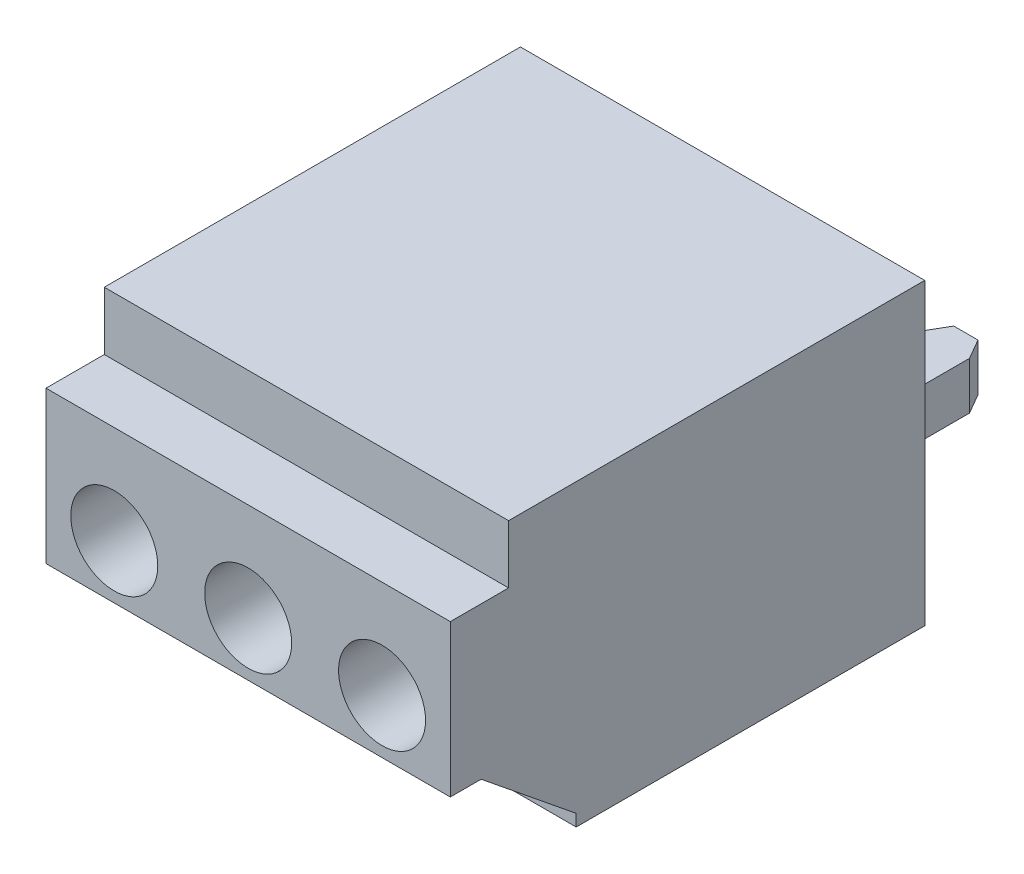
from build123d import *
from OCP.BRepFilletAPI import BRepFilletAPI_MakeChamfer

# Parameters (mm, degrees)
SKETCH1_W           = 15.34
SKETCH1_H           = 11.35
BOSS_EXTRUDE1_DEPTH = 18
SKETCH1_3_W         = 1.8
SKETCH1_3_H         = 1.8
BOSS_EXTRUDE2_DEPTH = 4
CHAMFER1_SIZE       = 0.762
CHAMFER1_SIZE2      = 0.439940905
SKETCH3_W           = 2.211259549
SKETCH3_H           = 2.211259549
CUT_EXTRUDE1_DEPTH  = 27.232386472
SKETCH4_R           = 1.650097839
CUT_EXTRUDE2_DEPTH  = 4
SKETCH2_W           = 3.858538726
SKETCH2_H           = 3.6
CUT_EXTRUDE3_DEPTH  = 4


with BuildPart() as part:
    # Sketch1 → Boss-Extrude1 (new body)
    with BuildSketch(Plane.XY):
        with Locations((7.67, 5.675)):
            Rectangle(SKETCH1_W, SKETCH1_H)
    extrude(amount=BOSS_EXTRUDE1_DEPTH)

    # Sketch1<3> → Boss-Extrude2 (add)
    with BuildSketch(Plane.XY):
        with Locations((2.54, 5.5)):
            Rectangle(SKETCH1_3_W, SKETCH1_3_H)
        with Locations((7.72, 5.5)):
            Rectangle(SKETCH1_3_W, SKETCH1_3_H)
        with Locations((12.9, 5.5)):
            Rectangle(SKETCH1_3_W, SKETCH1_3_H)
    extrude(amount=-BOSS_EXTRUDE2_DEPTH)

    # Chamfer1: one chamfer whose edges measure the first distance from different faces: ONE call of the kernel's chamfer builder (chamfer() names one face for all edges)
    chamfer1_edges_1 = [part.edges().sort_by_distance(p)[0] for p in [
        (1.64, 5.5, -4),
    ]]
    chamfer1_side_1 = [part.faces().sort_by_distance(p)[0] for p in [
        (1.64, 5.5, -2),
    ]]
    chamfer1_edges_2 = [part.edges().sort_by_distance(p)[0] for p in [
        (3.44, 5.5, -4),
    ]]
    chamfer1_side_2 = [part.faces().sort_by_distance(p)[0] for p in [
        (3.44, 5.5, -2),
    ]]
    chamfer1_edges_3 = [part.edges().sort_by_distance(p)[0] for p in [
        (6.82, 5.5, -4),
    ]]
    chamfer1_side_3 = [part.faces().sort_by_distance(p)[0] for p in [
        (6.82, 5.5, -2),
    ]]
    chamfer1_edges_4 = [part.edges().sort_by_distance(p)[0] for p in [
        (8.62, 5.5, -4),
    ]]
    chamfer1_side_4 = [part.faces().sort_by_distance(p)[0] for p in [
        (8.62, 5.5, -2),
    ]]
    chamfer1_edges_5 = [part.edges().sort_by_distance(p)[0] for p in [
        (12, 5.5, -4),
    ]]
    chamfer1_side_5 = [part.faces().sort_by_distance(p)[0] for p in [
        (12, 5.5, -2),
    ]]
    chamfer1_edges_6 = [part.edges().sort_by_distance(p)[0] for p in [
        (13.8, 5.5, -4),
    ]]
    chamfer1_side_6 = [part.faces().sort_by_distance(p)[0] for p in [
        (13.8, 5.5, -2),
    ]]
    chamfer1 = BRepFilletAPI_MakeChamfer(part.part.solid().wrapped)
    for e in chamfer1_edges_1:
        chamfer1.Add(CHAMFER1_SIZE, CHAMFER1_SIZE2, e.wrapped, chamfer1_side_1[0].wrapped)  # the first distance lies on this face
    for e in chamfer1_edges_2:
        chamfer1.Add(CHAMFER1_SIZE, CHAMFER1_SIZE2, e.wrapped, chamfer1_side_2[0].wrapped)  # the first distance lies on this face
    for e in chamfer1_edges_3:
        chamfer1.Add(CHAMFER1_SIZE, CHAMFER1_SIZE2, e.wrapped, chamfer1_side_3[0].wrapped)  # the first distance lies on this face
    for e in chamfer1_edges_4:
        chamfer1.Add(CHAMFER1_SIZE, CHAMFER1_SIZE2, e.wrapped, chamfer1_side_4[0].wrapped)  # the first distance lies on this face
    for e in chamfer1_edges_5:
        chamfer1.Add(CHAMFER1_SIZE, CHAMFER1_SIZE2, e.wrapped, chamfer1_side_5[0].wrapped)  # the first distance lies on this face
    for e in chamfer1_edges_6:
        chamfer1.Add(CHAMFER1_SIZE, CHAMFER1_SIZE2, e.wrapped, chamfer1_side_6[0].wrapped)  # the first distance lies on this face
    add(Compound.cast(chamfer1.Shape()), mode=Mode.REPLACE)

    # Sketch3 → Cut-Extrude1 (cut, through all)
    with BuildSketch(Plane.ZY):
        with Locations((16.894370226, 10.244370226)):
            Rectangle(SKETCH3_W, SKETCH3_H)
        Polygon((18, 0), (18, 3.37428008), (16.831701498, 3.37428008), (13.224191742, 0.450816104), (13.224191742, 0), align=None)
    extrude(amount=-CUT_EXTRUDE1_DEPTH, mode=Mode.SUBTRACT)

    # Sketch4 → Cut-Extrude2 (cut)
    with BuildSketch(Plane.XY.offset(18)):
        with Locations((2.59, 5.419196483)):
            Circle(SKETCH4_R)
        with Locations((7.67, 5.419196483)):
            Circle(SKETCH4_R)
        with Locations((12.75, 5.419196483)):
            Circle(SKETCH4_R)
    extrude(amount=-CUT_EXTRUDE2_DEPTH, mode=Mode.SUBTRACT)

    # Sketch2 → Cut-Extrude3 (cut)
    with BuildSketch(Plane.XZ):
        with Locations((2.59, 5.3)):
            Rectangle(SKETCH2_W, SKETCH2_H)
        with Locations((7.67, 5.3)):
            Rectangle(SKETCH2_W, SKETCH2_H)
        with Locations((12.75, 5.3)):
            Rectangle(SKETCH2_W, SKETCH2_H)
    extrude(amount=-CUT_EXTRUDE3_DEPTH, mode=Mode.SUBTRACT)


solid = part.part
